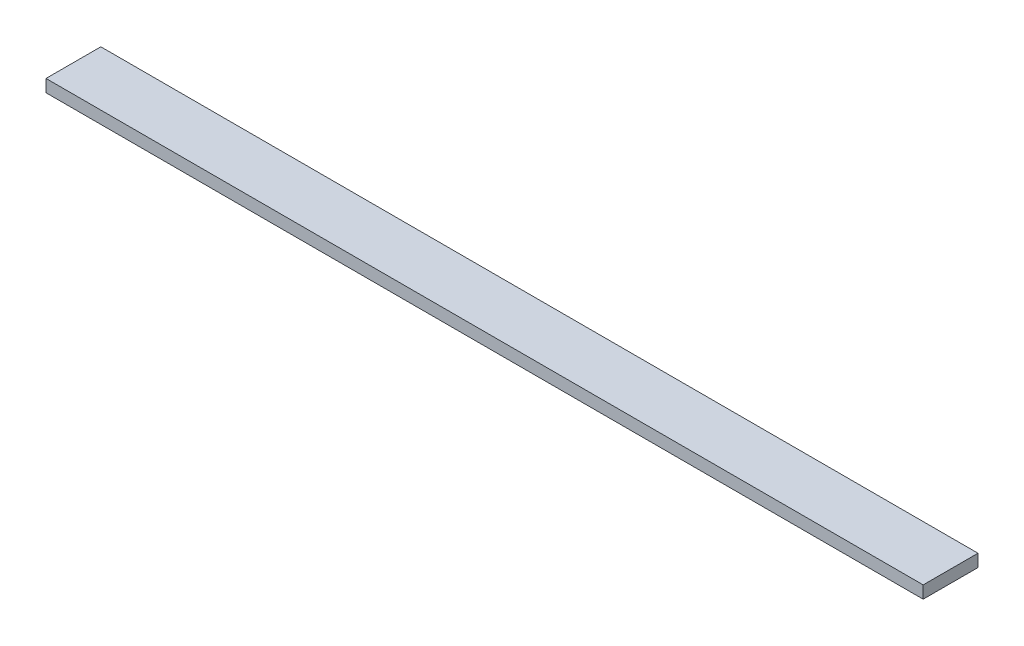
from build123d import *

# Parameters (mm, degrees)
SKETCH1_W           = 1200
SKETCH1_H           = 75
BOSS_EXTRUDE1_DEPTH = 17


with BuildPart() as part:
    # Sketch1 → Boss-Extrude1 (new body)
    with BuildSketch(Plane(origin=(0, 0, 0), x_dir=(1, 0, 0), z_dir=(0, 1, 0))):
        Rectangle(SKETCH1_W, SKETCH1_H)
    extrude(amount=BOSS_EXTRUDE1_DEPTH)


solid = part.part
